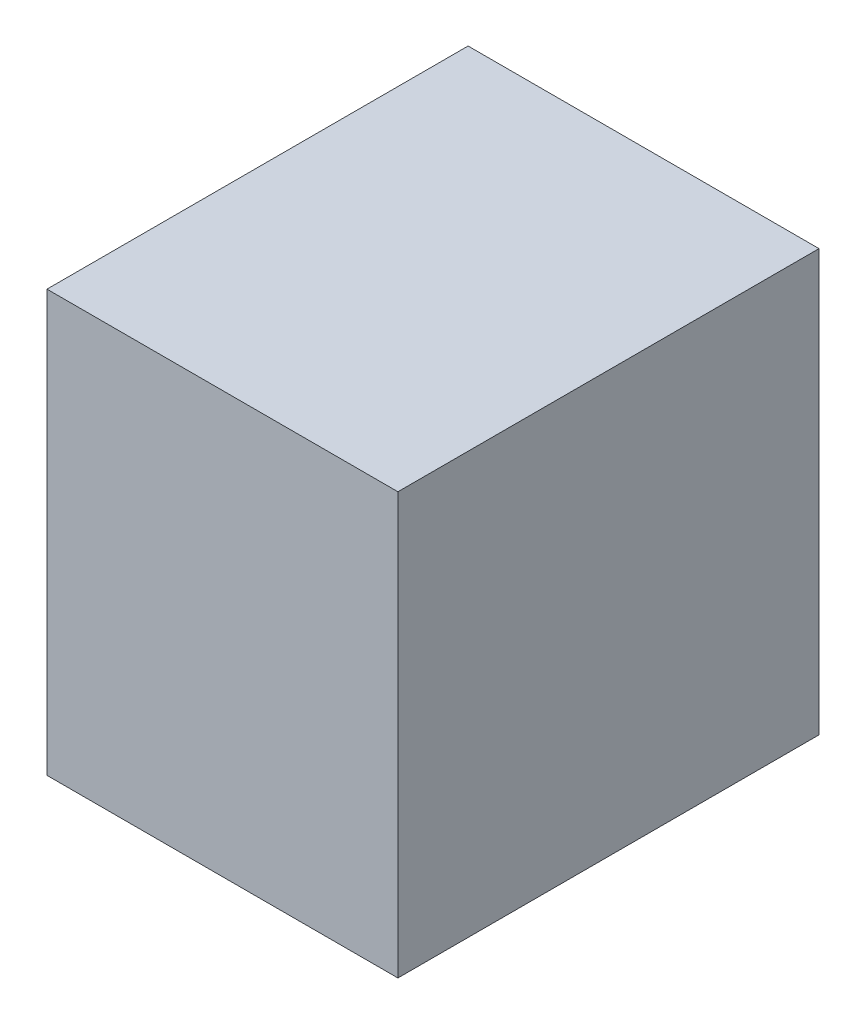
from build123d import *

# Parameters (mm, degrees)
PACK_FLAP_SERVO_25KGCM_1_1_START = -170
SKETCH1_W                        = 50
SKETCH1_H                        = 60
PACK_FLAP_SERVO_25KGCM_1_1_DEPTH = 60


with BuildPart() as part:
    # Sketch1 → PACK_flap_servo_25kgcm_1_1 (new body)
    with BuildSketch(Plane.XY.offset(PACK_FLAP_SERVO_25KGCM_1_1_START)):
        with Locations((150, 670)):
            Rectangle(SKETCH1_W, SKETCH1_H)
    extrude(amount=-PACK_FLAP_SERVO_25KGCM_1_1_DEPTH)


solid = part.part
